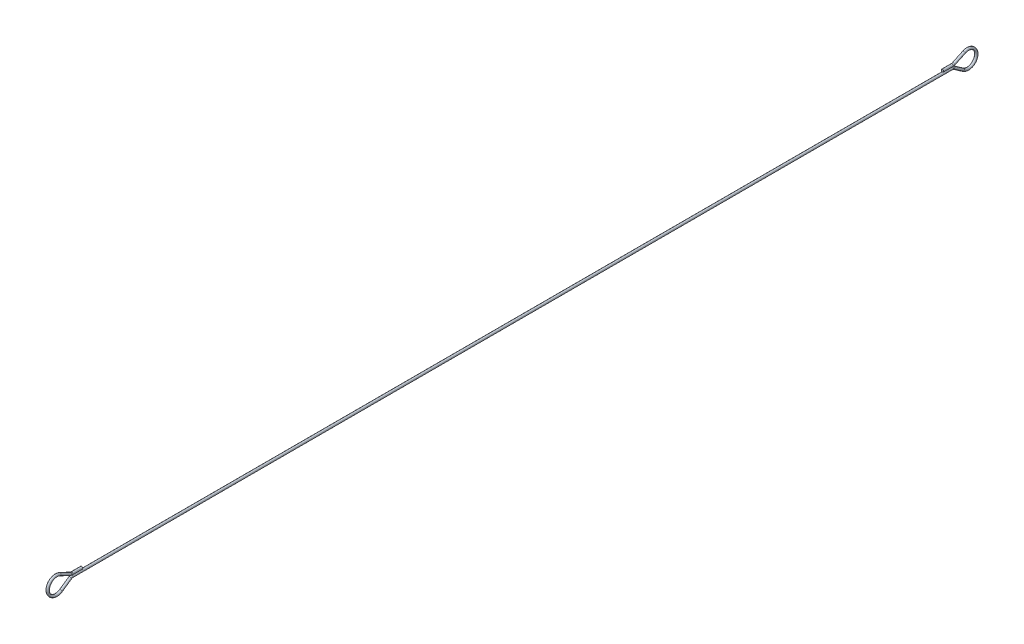
from build123d import *

# Parameters (mm, degrees)
SKETCH2_R = 1.5875


with BuildPart() as part:
    # Sweep1: sweep along a path in Sketch1
    with BuildLine(Plane(origin=(0, 0, 0), x_dir=(0, 0, -1), z_dir=(1, 0, 0))) as sweep1_path:
        Line((0, 0), (-577.889079714, 0))
        ThreePointArc((-577.889079714, 0), (-578.838359511, -0.145232209), (-579.700794583, -0.567642289))
        Line((-579.700794583, -0.567642289), (-592.089573308, -9.175948905))
        ThreePointArc((-592.089573308, -9.175948905), (-609.6, -0.933700659), (-593.706790289, 10.109649564))
        Line((-593.706790289, 10.109649564), (-580.057388714, 3.684805775))
        ThreePointArc((-580.057388714, 3.684805775), (-579.000002816, 3.322679475), (-577.889079714, 3.2))
        Line((-577.889079714, 3.2), (-565.189079714, 3.2))
    # Sketch2 → Sweep1 (sweep)
    with BuildSketch(Plane.XY):
        Circle(SKETCH2_R)
    sweep1 = sweep(path=sweep1_path.line)

    # Mirror1: Sweep1 across plane
    add(sweep1.mirror(Plane.XY))


solid = part.part
